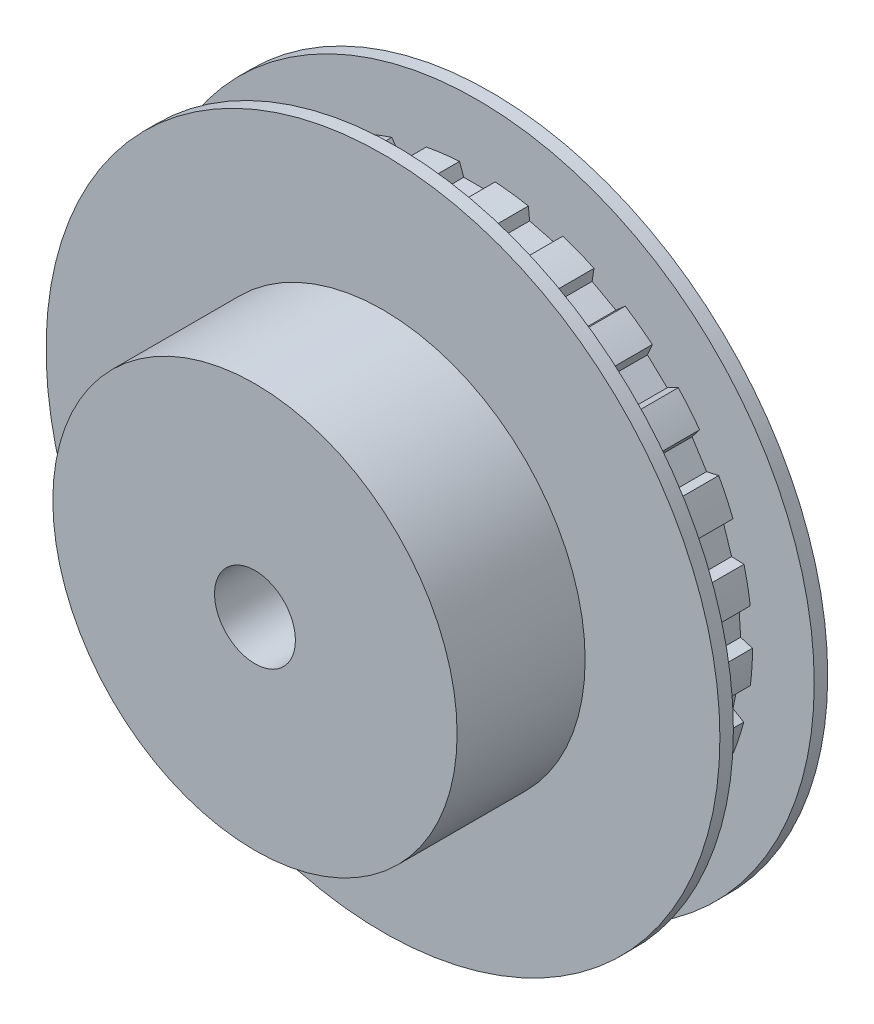
from build123d import *

# Parameters (mm, degrees)
SKETCH2_R           = 20.417784581
BOSS_EXTRUDE1_DEPTH = 3
CUT_EXTRUDE3_DEPTH  = 6
SKETCH5_R           = 25
BOSS_EXTRUDE2_DEPTH = 1
SKETCH6_R           = 15
BOSS_EXTRUDE3_DEPTH = 9.5
SKETCH8_R           = 3
CUT_EXTRUDE4_DEPTH  = 40.449334595


with BuildPart() as part:
    # Sketch2 → Boss-Extrude1 (new, symmetric)
    with BuildSketch(Plane.XY):
        Circle(SKETCH2_R)
    extrude(amount=BOSS_EXTRUDE1_DEPTH, both=True)

    # Sketch4 → Cut-Extrude3 (cut)
    with BuildSketch(Plane.XY.offset(3)):
        Polygon((1.006646689, 19.511049769), (1.376859102, 20.528200014), (-1.376813629, 20.528075077), (-1.006601216, 19.510924833), align=None)
        Polygon((5.827221798, 18.647731411), (6.438758286, 19.540857927), (3.771566178, 20.225547476), (3.877192707, 19.148284794), align=None)
        Polygon((10.28165113, 16.612707507), (11.096086608, 17.32569187), (8.682964611, 18.652174343), (8.517368354, 17.582487599), align=None)
        Polygon((14.090046509, 13.533846092), (15.056206999, 14.021888874), (13.048780443, 15.906816498), (12.622366422, 14.911918045), align=None)
        Polygon((17.013112445, 9.604603354), (18.070290531, 9.837039031), (16.59469341, 12.161974871), (15.934254785, 11.304377837), align=None)
        Polygon((18.867181957, 5.071868063), (19.948951252, 5.034091847), (19.09790076, 7.652951634), (18.244935319, 6.986541995), align=None)
        Polygon((19.535757038, 0.22044865), (20.574145998, -0.085165841), (20.401116767, 2.663065301), (19.409219466, 2.229716025), align=None)
        Polygon((18.976828657, -4.644822364), (19.906591485, -5.199072246), (20.422455578, -2.49415122), (19.353950973, -2.667211203), align=None)
        Polygon((17.225516339, -9.218242105), (17.988232618, -9.986301822), (19.160576396, -7.494651046), (18.08260256, -7.396547742), align=None)
        Polygon((14.391861479, -13.212445793), (14.939606939, -14.146055326), (16.694767732, -12.024234384), (15.675057726, -11.661131984), align=None)
        Polygon((10.653913032, -16.37646292), (10.952270812, -17.416960149), (13.179965412, -15.798290853), (12.282591366, -15.193004416), align=None)
        Polygon((6.246540048, -18.511486653), (6.27676323, -19.593493311), (8.837017393, -18.579682606), (8.118364618, -17.770244505), align=None)
        Polygon((1.446673978, -19.483365599), (1.20686353, -20.538895228), (3.93880707, -20.19364457), (3.444031164, -19.230914778), align=None)
        Polygon((-3.444091937, -19.23103303), (-3.938867844, -20.193762822), (-1.206892986, -20.538765578), (-1.446703434, -19.483235948), align=None)
        Polygon((-8.11845289, -17.770343928), (-8.837105665, -18.579782029), (-6.276759518, -19.593360409), (-6.246536335, -18.51135375), align=None)
        Polygon((-12.28270159, -15.193078763), (-13.180075636, -15.7983652), (-10.952234165, -17.416832345), (-10.653876385, -16.376335116), align=None)
        Polygon((-15.675182977, -11.661176583), (-16.694892983, -12.024278984), (-14.939539659, -14.145940651), (-14.391794199, -13.212331118), align=None)
        Polygon((-18.082734968, -7.396559792), (-19.160708804, -7.494663096), (-17.988138933, -9.986207481), (-17.225422655, -9.218147765), align=None)
        Polygon((-19.354082217, -2.667189946), (-20.422586822, -2.494129963), (-19.906477283, -5.199004168), (-18.976714454, -4.644754285), align=None)
        Polygon((-19.409341301, 2.229769254), (-20.401238602, 2.663118529), (-20.574018453, -0.085128303), (-19.535629493, 0.220486188), align=None)
        Polygon((-18.245040089, 6.98662385), (-19.098005529, 7.653033489), (-19.948818379, 5.034096487), (-18.867049084, 5.071872703), align=None)
        Polygon((-15.934335907, 11.304483176), (-16.594774532, 12.162080209), (-18.070160678, 9.837010481), (-17.012982592, 9.604574804), align=None)
        Polygon((-12.622418798, 14.912040248), (-13.04883282, 15.906938701), (-15.056088326, 14.021828928), (-14.089927835, 13.533786146), align=None)
        Polygon((-8.517388694, 17.582618989), (-8.682984951, 18.652305732), (-11.095986571, 17.325604294), (-10.281551093, 16.612619931), align=None)
        Polygon((-3.877179733, 19.148417114), (-3.771553204, 20.225679796), (-6.438683171, 19.540748224), (-5.827146683, 18.647621709), align=None)
    extrude(amount=-CUT_EXTRUDE3_DEPTH, mode=Mode.SUBTRACT)

    # Sketch5 → Boss-Extrude2 (add)
    with BuildSketch(Plane.XY.offset(3)):
        Circle(SKETCH5_R)
    boss_extrude2 = extrude(amount=BOSS_EXTRUDE2_DEPTH)

    # Mirror2: Boss-Extrude2 across plane
    add(boss_extrude2.mirror(Plane.XY))

    # Sketch6 → Boss-Extrude3 (add)
    with BuildSketch(Plane.XY.offset(4)):
        Circle(SKETCH6_R)
    extrude(amount=BOSS_EXTRUDE3_DEPTH)

    # Sketch8 → Cut-Extrude4 (cut, through all)
    with BuildSketch(Plane.XY.offset(13.5)):
        Circle(SKETCH8_R)
    extrude(amount=-CUT_EXTRUDE4_DEPTH, mode=Mode.SUBTRACT)


solid = part.part
